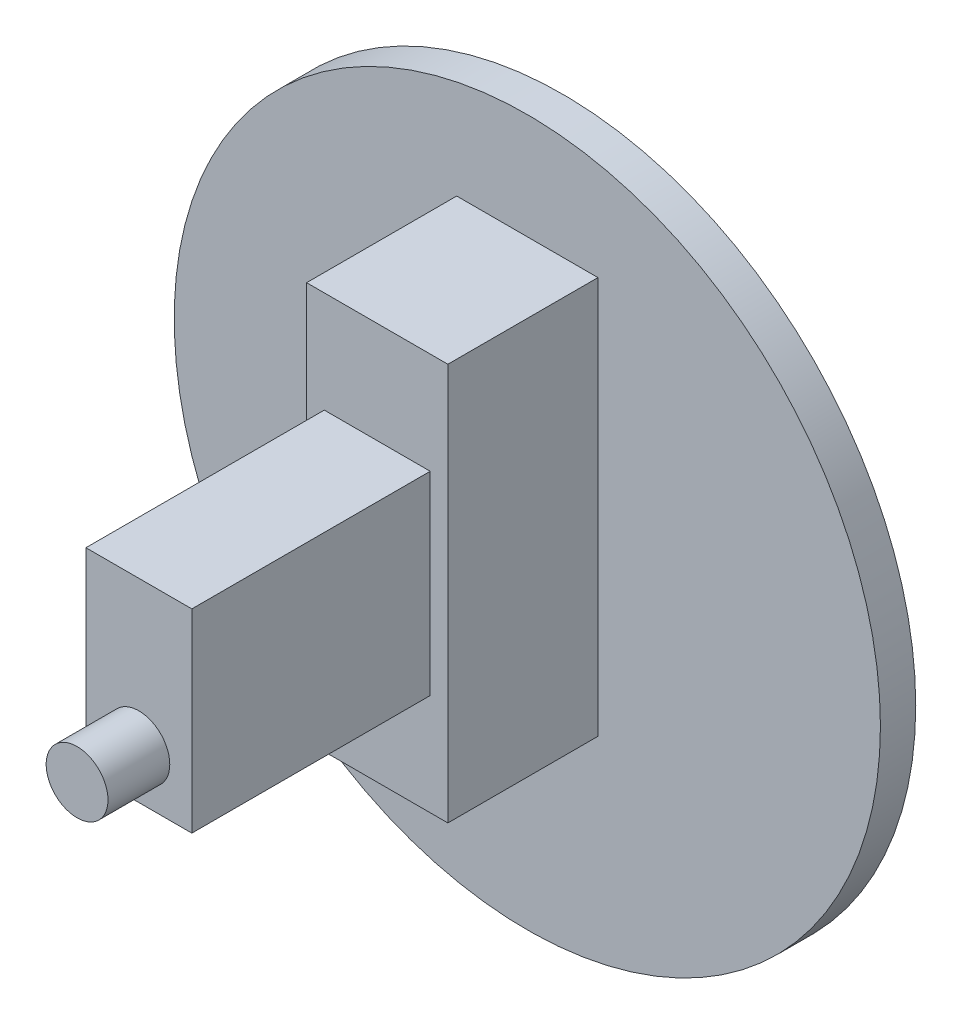
from build123d import *

# Parameters (mm, degrees)
SKIZZE1_R                       = 40
AUFSATZ_LINEAR_AUSTRAGEN1_DEPTH = 4
SKIZZE2_W                       = 16
SKIZZE2_H                       = 45
AUFSATZ_LINEAR_AUSTRAGEN2_DEPTH = 17
SKIZZE3_W                       = 12
SKIZZE3_H                       = 22
AUFSATZ_LINEAR_AUSTRAGEN3_DEPTH = 27
SKIZZE4_R                       = 3.5
AUFSATZ_LINEAR_AUSTRAGEN4_DEPTH = 7


with BuildPart() as part:
    # Skizze1 → Aufsatz-Linear austragen1 (new body)
    with BuildSketch(Plane.XY):
        Circle(SKIZZE1_R)
    extrude(amount=AUFSATZ_LINEAR_AUSTRAGEN1_DEPTH)

    # Skizze2 → Aufsatz-Linear austragen2 (add)
    with BuildSketch(Plane.XY.offset(4)):
        with Locations((0, 5.5)):
            Rectangle(SKIZZE2_W, SKIZZE2_H)
    extrude(amount=AUFSATZ_LINEAR_AUSTRAGEN2_DEPTH)

    # Skizze3 → Aufsatz-Linear austragen3 (add)
    with BuildSketch(Plane.XY.offset(21)):
        with Locations((0, 5.5)):
            Rectangle(SKIZZE3_W, SKIZZE3_H)
    extrude(amount=AUFSATZ_LINEAR_AUSTRAGEN3_DEPTH)

    # Skizze4 → Aufsatz-Linear austragen4 (add)
    with BuildSketch(Plane.XY.offset(48)):
        Circle(SKIZZE4_R)
    extrude(amount=AUFSATZ_LINEAR_AUSTRAGEN4_DEPTH)


solid = part.part
